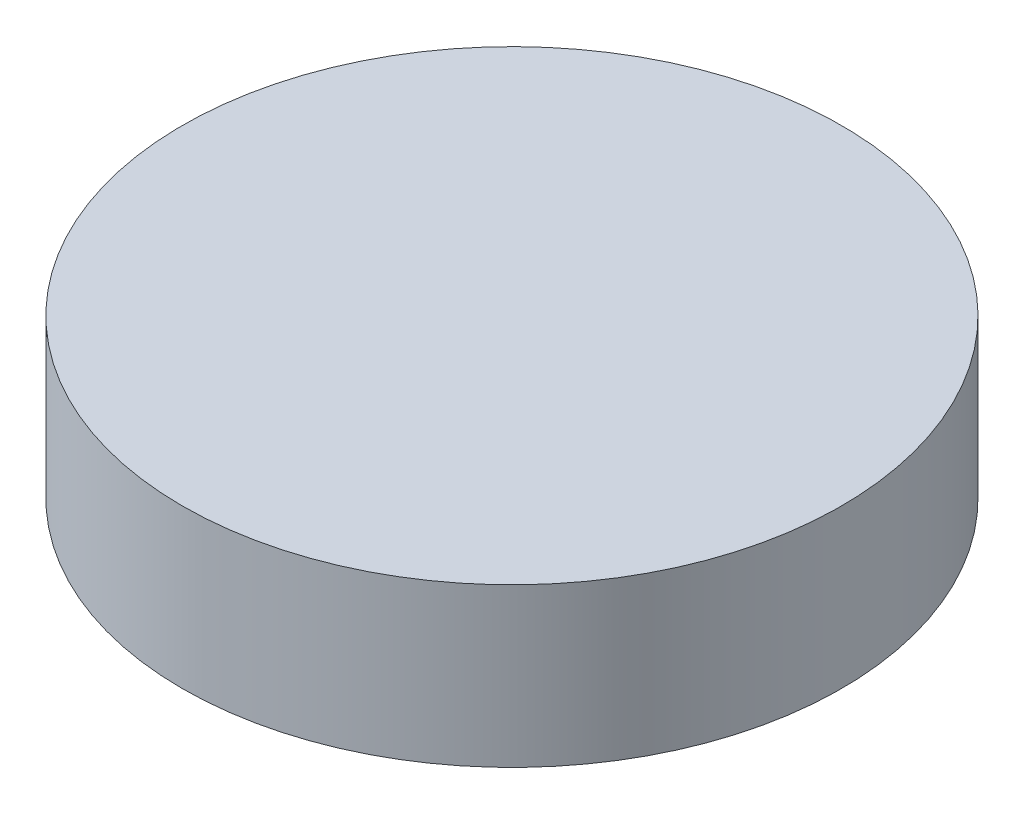
from build123d import *

# Parameters (mm, degrees)
SKETCH1_R               = 25
PACK_AYAR_AYAGI_3_DEPTH = 12


with BuildPart() as part:
    # Sketch1 → PACK_ayar_ayagi_3 (new body)
    with BuildSketch(Plane(origin=(0, 0, 0), x_dir=(1, 0, 0), z_dir=(0, 1, 0))):
        with Locations(Location((50, 770, 0), (0, 0, 270))):
            Circle(SKETCH1_R)
    extrude(amount=PACK_AYAR_AYAGI_3_DEPTH)


solid = part.part
